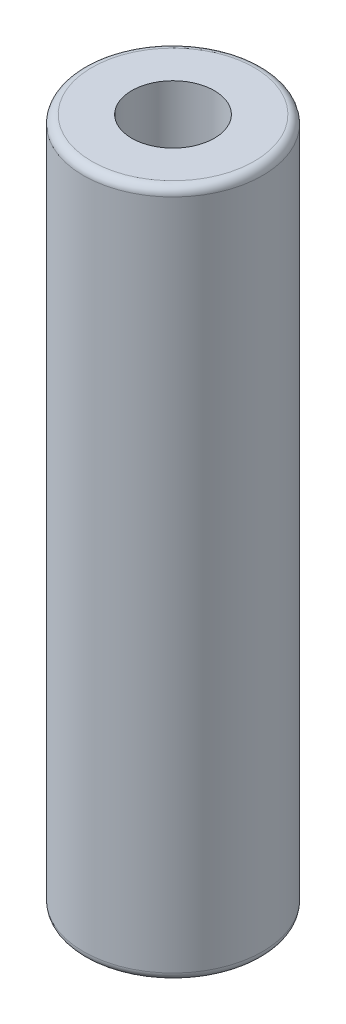
from build123d import *

# Parameters (mm, degrees)
ESBO_O1_R                = 3.25
RESSALTO_EXTRUS_O1_DEPTH = 25
ESBO_O2_R                = 1.5
CORTE_EXTRUS_O1_DEPTH    = 26.418988965
FILETE1_R                = 0.3


with BuildPart() as part:
    # Esboço1 → Ressalto-extrusão1 (new body)
    with BuildSketch(Plane(origin=(0, 0, 0), x_dir=(1, 0, 0), z_dir=(0, 1, 0))):
        with Locations(Location((0, 0, 0), (0, 0, 270))):
            Circle(ESBO_O1_R)
    extrude(amount=RESSALTO_EXTRUS_O1_DEPTH)

    # Esboço2 → Corte-extrusão1 (cut, through all)
    with BuildSketch(Plane(origin=(0, 25, 0), x_dir=(1, 0, 0), z_dir=(0, 1, 0))):
        with Locations(Location((0, 0, 0), (0, 0, 270))):
            Circle(ESBO_O2_R)
    extrude(amount=-CORTE_EXTRUS_O1_DEPTH, mode=Mode.SUBTRACT)

    # Filete1
    filete1_edges = [part.edges().sort_by_distance(p)[0] for p in [
        (0, 0, -3.25),
        (0, 25, -3.25),
    ]]
    fillet(filete1_edges, radius=FILETE1_R)


solid = part.part
